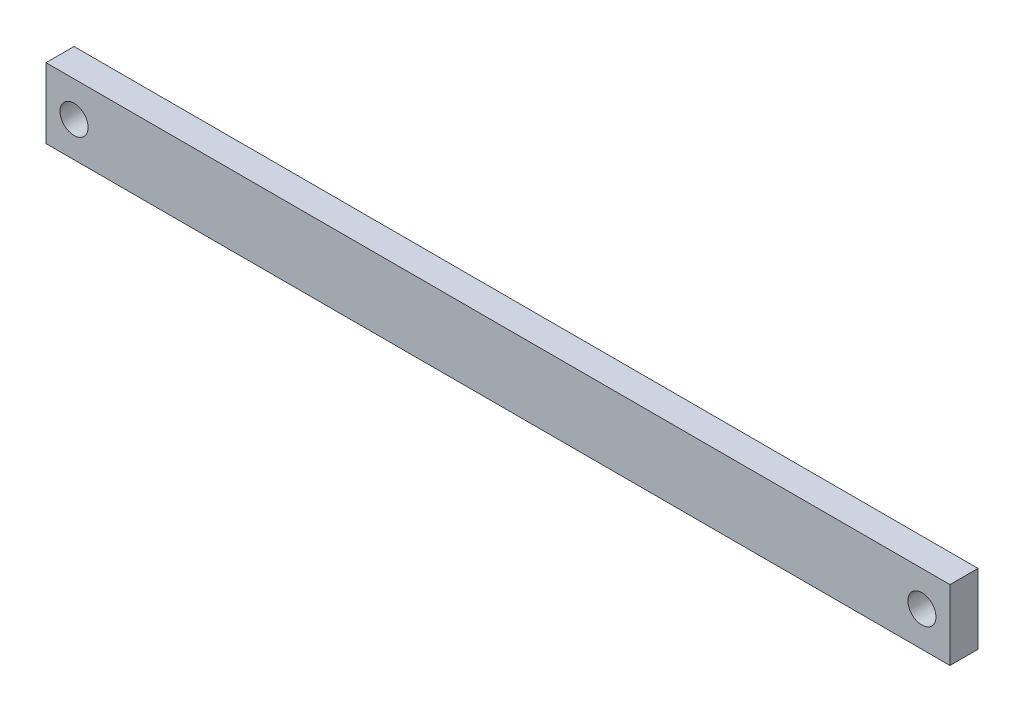
from build123d import *

# Parameters (mm, degrees)
SKETCH1_W           = 81.89214
SKETCH1_H           = 6.35
BOSS_EXTRUDE1_DEPTH = 2.54
SKETCH3_R           = 1.27
CUT_EXTRUDE1_DEPTH  = 42.147452818
SCALE1_SCALE        = 8


with BuildPart() as part:
    # Sketch1 → Boss-Extrude1 (new body)
    with BuildSketch(Plane.XY):
        Rectangle(SKETCH1_W, SKETCH1_H)
    extrude(amount=BOSS_EXTRUDE1_DEPTH)

    # Sketch3 → Cut-Extrude1 (cut, through all)
    with BuildSketch(Plane.XY):
        with Locations((-38.40607, 0)):
            Circle(SKETCH3_R)
    cut_extrude1 = extrude(amount=CUT_EXTRUDE1_DEPTH, mode=Mode.SUBTRACT)

    # Mirror1: Cut-Extrude1 across plane
    add(cut_extrude1.mirror(Plane(origin=(0, 0, 0), x_dir=(0, 0, 1), z_dir=(1, 0, 0))), mode=Mode.SUBTRACT)


with BuildPart() as part_1:
    # Scale1: scaled about (0, 0, 1.27)
    add(part.part.scale(SCALE1_SCALE).moved(Location((0, 0, -8.89))))


solid = part_1.part
